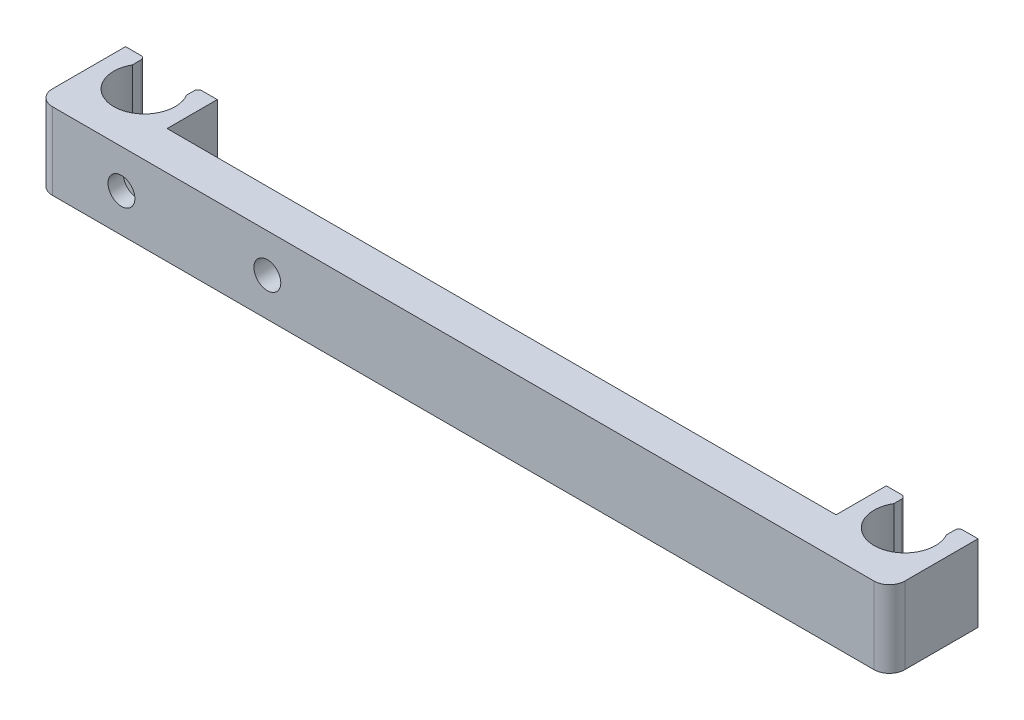
from build123d import *

# Parameters (mm, degrees)
BOSS_EXTRUDE1_DEPTH = 10
FILLET1_R           = 2
FILLET2_R           = 2
FILLET3_R           = 0.5
FILLET4_R           = 0.5
FILLET5_R           = 0.5
FILLET6_R           = 0.5
MOUNTING_HOLE_R     = 1.75
CUT_EXTRUDE1_DEPTH  = 5
MOUNTING_CONE_R     = 1.75
CUT_EXTRUDE2_DEPTH  = 2


with BuildPart() as part:
    # Clip → Boss-Extrude1 (new body)
    with BuildSketch(Plane(origin=(0, 0, 0), x_dir=(1, 0, 0), z_dir=(0, 1, 0))):
        with BuildLine():
            Line((-55.5, 0), (55.5, 0))
            Line((55.5, 0), (55.5, 11.536491673))
            Line((55.5, 11.536491673), (53, 11.536491673))
            Line((53, 11.536491673), (53, 9.936491673))
            ThreePointArc((53, 9.936491673), (49.442392127, 4.000414855), (46.057224715, 10.036491673))
            Line((46.057224715, 10.036491673), (46.057224715, 11.536491673))
            Line((46.057224715, 11.536491673), (43.557224715, 11.536491673))
            Line((43.557224715, 11.536491673), (43.557224715, 5))
            Line((43.557224715, 5), (-43.557224715, 5))
            Line((-43.557224715, 5), (-43.557224715, 11.536491673))
            Line((-43.557224715, 11.536491673), (-46.057224715, 11.536491673))
            Line((-46.057224715, 11.536491673), (-46.057224715, 10.036491673))
            ThreePointArc((-46.057224715, 10.036491673), (-49.442392127, 4.000414855), (-53, 9.936491673))
            Line((-53, 9.936491673), (-53, 11.536491673))
            Line((-53, 11.536491673), (-55.5, 11.536491673))
            Line((-55.5, 11.536491673), (-55.5, 0))
        make_face()
    extrude(amount=BOSS_EXTRUDE1_DEPTH)

    # Fillet1
    fillet1_edges = [part.edges().sort_by_distance(p)[0] for p in [
        (55.5, 5, 0),
    ]]
    fillet(fillet1_edges, radius=FILLET1_R)

    # Fillet2
    fillet2_edges = [part.edges().sort_by_distance(p)[0] for p in [
        (-55.5, 5, 0),
    ]]
    fillet(fillet2_edges, radius=FILLET2_R)

    # Fillet3
    fillet3_edges = [part.edges().sort_by_distance(p)[0] for p in [
        (46.057224715, 5, -11.536491673),
    ]]
    fillet(fillet3_edges, radius=FILLET3_R)

    # Fillet4
    fillet4_edges = [part.edges().sort_by_distance(p)[0] for p in [
        (53, 5, -11.536491673),
    ]]
    fillet(fillet4_edges, radius=FILLET4_R)

    # Fillet5
    fillet5_edges = [part.edges().sort_by_distance(p)[0] for p in [
        (-53, 5, -11.536491673),
    ]]
    fillet(fillet5_edges, radius=FILLET5_R)

    # Fillet6
    fillet6_edges = [part.edges().sort_by_distance(p)[0] for p in [
        (-46.057224715, 5, -11.536491673),
    ]]
    fillet(fillet6_edges, radius=FILLET6_R)

    # Mounting Hole → Cut-Extrude1 (cut)
    with BuildSketch(Plane.XY):
        with Locations((-25.5, 5)):
            Circle(MOUNTING_HOLE_R)
    extrude(amount=-CUT_EXTRUDE1_DEPTH, mode=Mode.SUBTRACT)

    # Mounting Cone → Cut-Extrude2 (cut)
    with BuildSketch(Plane.XY):
        with Locations((-44.5, 5)):
            Circle(MOUNTING_CONE_R)
    extrude(amount=-CUT_EXTRUDE2_DEPTH, mode=Mode.SUBTRACT)


solid = part.part
